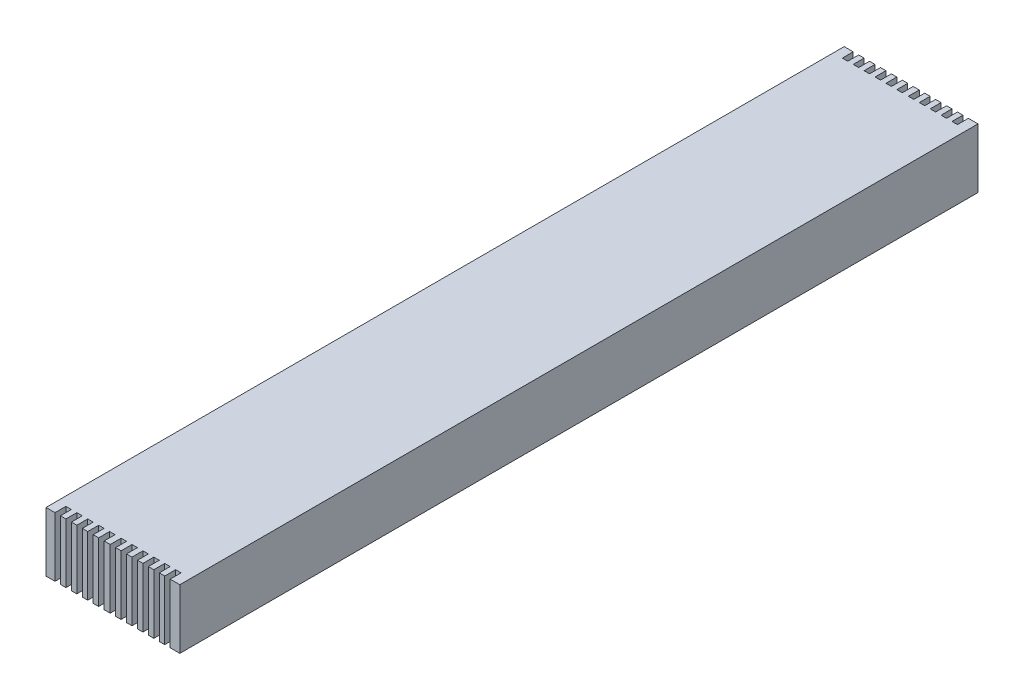
from build123d import *

# Parameters (mm, degrees)
BOSS_EXTRUDE1_DEPTH = 7315
CUT_EXTRUDE1_DEPTH  = 100
CUT_EXTRUDE2_DEPTH  = 100


with BuildPart() as part:
    # Sketch1 → Boss-Extrude1 (new body)
    with BuildSketch(Plane.XY):
        Polygon((390.286155145, -454.00220839), (340.286155145, -454.00220839), (340.286155145, -504.00220839), (290.286155145, -504.00220839), (290.286155145, -454.00220839), (240.286155145, -454.00220839), (240.286155145, -504.00220839), (184.64446635, -504.00220839), (184.64446635, -454.00220839), (134.64446635, -454.00220839), (134.64446635, -504.00220839), (84.64446635, -504.00220839), (84.64446635, -454.00220839), (34.64446635, -454.00220839), (34.64446635, -504.00220839), (-15.35553365, -504.00220839), (-15.35553365, -454.00220839), (-65.35553365, -454.00220839), (-65.35553365, -504.00220839), (-115.35553365, -504.00220839), (-115.35553365, -454.00220839), (-165.35553365, -454.00220839), (-165.35553365, -504.00220839), (-215.35553365, -504.00220839), (-215.35553365, -454.00220839), (-265.35553365, -454.00220839), (-265.35553365, -504.00220839), (-347.890991568, -504.00220839), (-347.890991568, 41.240606266), (878.463301858, 41.240606266), (878.463301858, -504.00220839), (790.286155145, -504.00220839), (790.286155145, -454.00220839), (740.286155145, -454.00220839), (740.286155145, -504.00220839), (690.286155145, -504.00220839), (690.286155145, -454.00220839), (640.286155145, -454.00220839), (640.286155145, -504.00220839), (590.286155145, -504.00220839), (590.286155145, -454.00220839), (540.286155145, -454.00220839), (540.286155145, -504.00220839), (490.286155145, -504.00220839), (490.286155145, -454.00220839), (440.286155145, -454.00220839), (440.286155145, -504.00220839), (390.286155145, -504.00220839), align=None)
    extrude(amount=BOSS_EXTRUDE1_DEPTH)

    # Sketch2 → Cut-Extrude1 (cut)
    with BuildSketch(Plane.XY.offset(7315)):
        Polygon((-265.35553365, -454.00220839), (-265.35553365, 201.707253547), (-265.35553365, 367.434180801), (790.286155145, 367.434180801), (790.286155145, -454.00220839), (740.286155145, -454.00220839), (740.286155145, 201.707253547), (690.286155145, 201.707253547), (690.286155145, -454.00220839), (640.286155145, -454.00220839), (640.286155145, 201.707253547), (590.286155145, 201.707253547), (590.286155145, -454.00220839), (540.286155145, -454.00220839), (540.286155145, 201.707253547), (490.286155145, 201.707253547), (490.286155145, -454.00220839), (440.286155145, -454.00220839), (440.286155145, 201.707253547), (390.286155145, 201.707253547), (390.286155145, -454.00220839), (340.286155145, -454.00220839), (340.286155145, 201.707253547), (290.286155145, 201.707253547), (290.286155145, -454.00220839), (240.286155145, -454.00220839), (240.286155145, 201.707253547), (184.64446635, 201.707253547), (184.64446635, -454.00220839), (134.64446635, -454.00220839), (134.64446635, 201.707253547), (84.64446635, 201.707253547), (84.64446635, -454.00220839), (34.64446635, -454.00220839), (34.64446635, 201.707253547), (-15.35553365, 201.707253547), (-15.35553365, -454.00220839), (-65.35553365, -454.00220839), (-65.35553365, 201.707253547), (-115.35553365, 201.707253547), (-115.35553365, -454.00220839), (-165.35553365, -454.00220839), (-165.35553365, 201.707253547), (-215.35553365, 201.707253547), (-215.35553365, -454.00220839), align=None)
    extrude(amount=-CUT_EXTRUDE1_DEPTH, mode=Mode.SUBTRACT)

    # Sketch3 → Cut-Extrude2 (cut)
    with BuildSketch(Plane(origin=(0, 0, 0), x_dir=(-1, 0, 0), z_dir=(0, 0, -1))):
        Polygon((-790.286155145, -454.00220839), (-790.286155145, 201.707253547), (-790.286155145, 367.434180801), (265.35553365, 367.434180801), (265.35553365, -454.00220839), (215.35553365, -454.00220839), (215.35553365, 201.707253547), (165.35553365, 201.707253547), (165.35553365, -454.00220839), (115.35553365, -454.00220839), (115.35553365, 201.707253547), (65.35553365, 201.707253547), (65.35553365, -454.00220839), (15.35553365, -454.00220839), (15.35553365, 201.707253547), (-34.64446635, 201.707253547), (-34.64446635, -454.00220839), (-84.64446635, -454.00220839), (-84.64446635, 201.707253547), (-134.64446635, 201.707253547), (-134.64446635, -454.00220839), (-184.64446635, -454.00220839), (-184.64446635, 201.707253547), (-234.64446635, 201.707253547), (-234.64446635, -454.00220839), (-284.64446635, -454.00220839), (-284.64446635, 201.707253547), (-340.286155145, 201.707253547), (-340.286155145, -454.00220839), (-390.286155145, -454.00220839), (-390.286155145, 201.707253547), (-440.286155145, 201.707253547), (-440.286155145, -454.00220839), (-490.286155145, -454.00220839), (-490.286155145, 201.707253547), (-540.286155145, 201.707253547), (-540.286155145, -454.00220839), (-590.286155145, -454.00220839), (-590.286155145, 201.707253547), (-640.286155145, 201.707253547), (-640.286155145, -454.00220839), (-690.286155145, -454.00220839), (-690.286155145, 201.707253547), (-740.286155145, 201.707253547), (-740.286155145, -454.00220839), align=None)
    extrude(amount=-CUT_EXTRUDE2_DEPTH, mode=Mode.SUBTRACT)


solid = part.part
